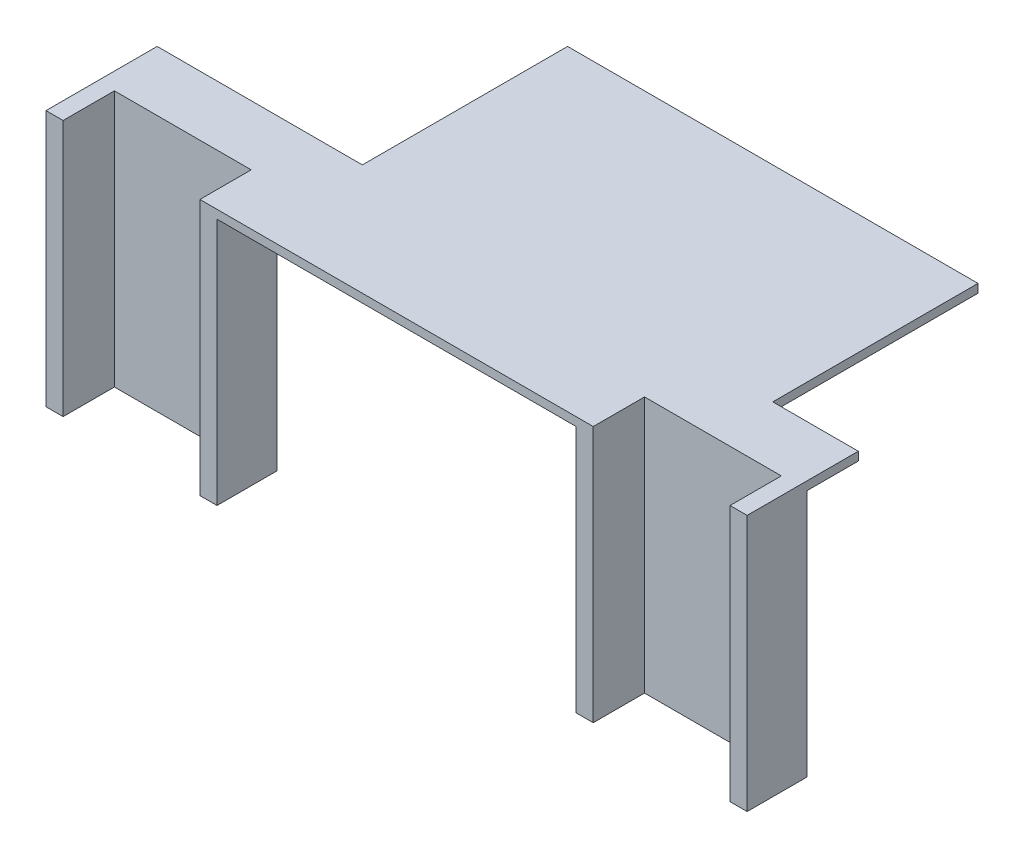
from build123d import *

# Parameters (mm, degrees)
SKETCH1_W           = 410
SKETCH1_H           = 150
BOSS_EXTRUDE1_DEPTH = 35
SKETCH2_W           = 410
SKETCH2_H           = 5
BOSS_EXTRUDE2_DEPTH = 150
SKETCH3_W           = 80
SKETCH3_H           = 150
CUT_EXTRUDE1_DEPTH  = 30
SKETCH4_W           = 210
SKETCH4_H           = 145
CUT_EXTRUDE2_DEPTH  = 35
SKETCH5_W           = 120
SKETCH5_H           = 120
CUT_EXTRUDE3_DEPTH  = 10
SKETCH6_W           = 50
SKETCH6_H           = 120
CUT_EXTRUDE4_DEPTH  = 10


with BuildPart() as part:
    # Sketch1 → Boss-Extrude1 (new body)
    with BuildSketch(Plane.XY):
        with Locations((205, 75)):
            Rectangle(SKETCH1_W, SKETCH1_H)
    extrude(amount=BOSS_EXTRUDE1_DEPTH)

    # Sketch2 → Boss-Extrude2 (add)
    with BuildSketch(Plane(origin=(0, 0, 0), x_dir=(-1, 0, 0), z_dir=(0, 0, -1))):
        with Locations((-205, 147.5)):
            Rectangle(SKETCH2_W, SKETCH2_H)
    extrude(amount=BOSS_EXTRUDE2_DEPTH)

    # Sketch3 → Cut-Extrude1 (cut)
    with BuildSketch(Plane.XY.offset(35)):
        with Locations((50, 75)):
            Rectangle(SKETCH3_W, SKETCH3_H)
        with Locations((360, 75)):
            Rectangle(SKETCH3_W, SKETCH3_H)
    extrude(amount=-CUT_EXTRUDE1_DEPTH, mode=Mode.SUBTRACT)

    # Sketch4 → Cut-Extrude2 (cut)
    with BuildSketch(Plane.XY.offset(35)):
        with Locations((205, 72.5)):
            Rectangle(SKETCH4_W, SKETCH4_H)
    extrude(amount=-CUT_EXTRUDE2_DEPTH, mode=Mode.SUBTRACT)

    # Sketch5 → Cut-Extrude3 (cut)
    with BuildSketch(Plane(origin=(0, 150, 0), x_dir=(1, 0, 0), z_dir=(0, 1, 0))):
        with Locations((60, 90)):
            Rectangle(SKETCH5_W, SKETCH5_H)
    extrude(amount=-CUT_EXTRUDE3_DEPTH, mode=Mode.SUBTRACT)

    # Sketch6 → Cut-Extrude4 (cut)
    with BuildSketch(Plane(origin=(0, 150, 0), x_dir=(1, 0, 0), z_dir=(0, 1, 0))):
        with Locations((385, 90)):
            Rectangle(SKETCH6_W, SKETCH6_H)
    extrude(amount=-CUT_EXTRUDE4_DEPTH, mode=Mode.SUBTRACT)


solid = part.part
